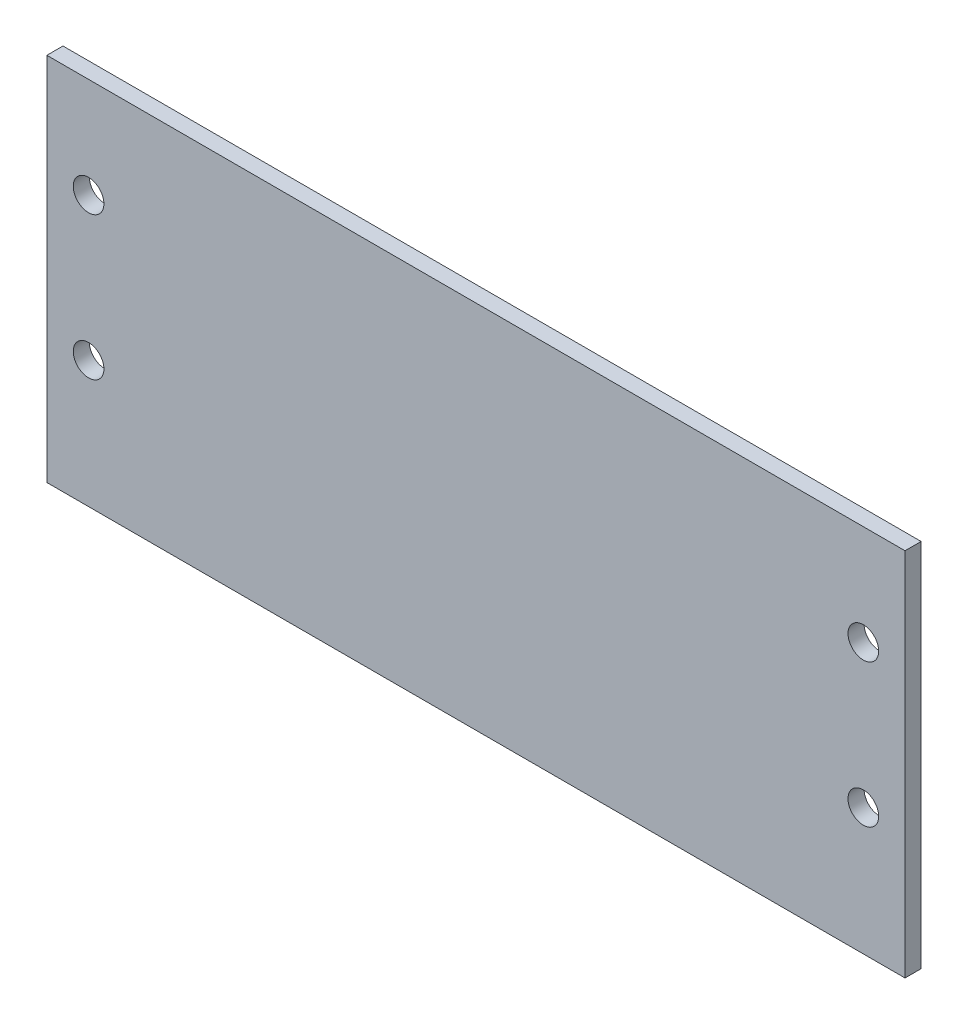
from build123d import *

# Parameters (mm, degrees)
SKETCH1_W           = 533.4
SKETCH1_H           = 230
BOSS_EXTRUDE1_DEPTH = 10
SKETCH2_R           = 9.525
CUT_EXTRUDE1_DEPTH  = 10


with BuildPart() as part:
    # Sketch1 → Boss-Extrude1 (new body)
    with BuildSketch(Plane.XY):
        with Locations((-8.287878788, 15.65034965)):
            Rectangle(SKETCH1_W, SKETCH1_H)
    extrude(amount=BOSS_EXTRUDE1_DEPTH)

    # Sketch2 → Cut-Extrude1 (cut)
    with BuildSketch(Plane.XY.offset(10)):
        with Locations((232.504121212, 68.37234965)):
            Circle(SKETCH2_R)
        with Locations((232.504121212, -20.52765035)):
            Circle(SKETCH2_R)
        with Locations((-249.079878788, 68.37234965)):
            Circle(SKETCH2_R)
        with Locations((-249.079878788, -20.52765035)):
            Circle(SKETCH2_R)
    extrude(amount=-CUT_EXTRUDE1_DEPTH, mode=Mode.SUBTRACT)


solid = part.part
